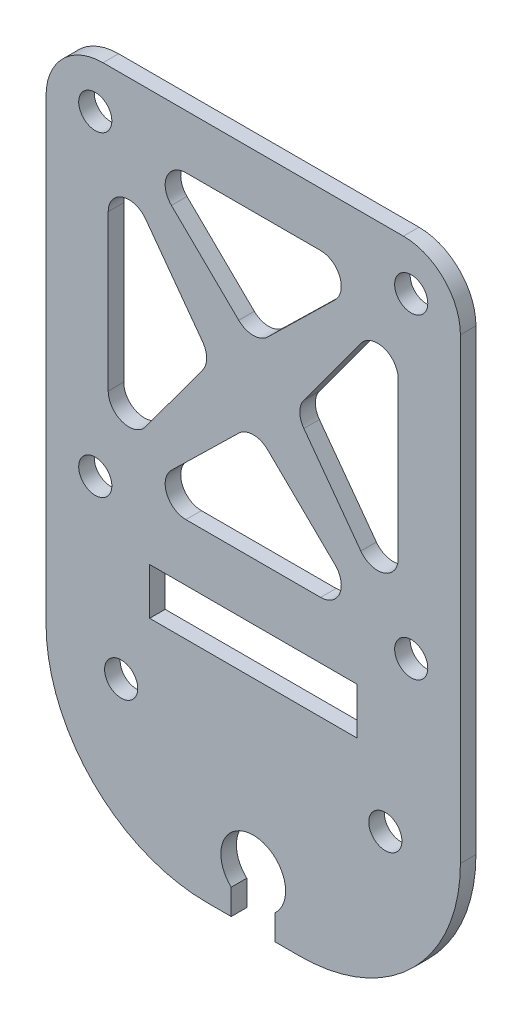
from build123d import *

# Parameters (mm, degrees)
SKETCH1_R           = 1.6
SKETCH1_W           = 20
SKETCH1_H           = 4.5
BOSS_EXTRUDE1_DEPTH = 0.75


with BuildPart() as part:
    # Sketch1 → Boss-Extrude1 (new, symmetric)
    with BuildSketch(Plane.XY):
        with BuildLine():
            Line((-20, 14.2), (-20, -30))
            ThreePointArc((-20, -30), (-15.460155108, -40.960155108), (-4.5, -45.5))
            Line((-4.5, -45.5), (-2.123950753, -45.5))
            Line((-2.123950753, -45.5), (-2.123950753, -43.0422605))
            ThreePointArc((-2.123950753, -43.0422605), (0, -37.625), (2.123950753, -43.0422605))
            Line((2.123950753, -43.0422605), (2.123950753, -45.5))
            Line((2.123950753, -45.5), (4.5, -45.5))
            ThreePointArc((4.5, -45.5), (15.460155108, -40.960155108), (20, -30))
            Line((20, -30), (20, 14.2))
            ThreePointArc((20, 14.2), (18.389087297, 18.089087297), (14.5, 19.7))
            Line((14.5, 19.7), (-14.5, 19.7))
            ThreePointArc((-14.5, 19.7), (-18.389087297, 18.089087297), (-20, 14.2))
        make_face()
        with Locations((-15.25, 15.25)):
            Circle(SKETCH1_R, mode=Mode.SUBTRACT)
        with Locations((15.25, 15.25)):
            Circle(SKETCH1_R, mode=Mode.SUBTRACT)
        with Locations((15.25, -15.25)):
            Circle(SKETCH1_R, mode=Mode.SUBTRACT)
        with Locations((-15.25, -15.25)):
            Circle(SKETCH1_R, mode=Mode.SUBTRACT)
        with Locations((12.75, -30.95)):
            Circle(SKETCH1_R, mode=Mode.SUBTRACT)
        with Locations((-12.75, -30.95)):
            Circle(SKETCH1_R, mode=Mode.SUBTRACT)
        with Locations((0, -22.25)):
            Rectangle(SKETCH1_W, SKETCH1_H, mode=Mode.SUBTRACT)
        with BuildLine():
            Line((-14, 7.5), (-14, -7.5))
            ThreePointArc((-14, -7.5), (-12.622245939, -9.400739328), (-10.387190008, -8.682727327))
            Line((-10.387190008, -8.682727327), (-4.887190008, -1.182727327))
            ThreePointArc((-4.887190008, -1.182727327), (-4.5, 0), (-4.887190008, 1.182727327))
            Line((-4.887190008, 1.182727327), (-10.387190008, 8.682727327))
            ThreePointArc((-10.387190008, 8.682727327), (-12.622245939, 9.400739328), (-14, 7.5))
        make_face(mode=Mode.SUBTRACT)
        with BuildLine():
            Line((4.887190008, 1.182727327), (10.387190008, 8.682727327))
            ThreePointArc((10.387190008, 8.682727327), (12.622245939, 9.400739328), (14, 7.5))
            Line((14, 7.5), (14, -7.5))
            ThreePointArc((14, -7.5), (12.622245939, -9.400739328), (10.387190008, -8.682727327))
            Line((10.387190008, -8.682727327), (4.887190008, -1.182727327))
            ThreePointArc((4.887190008, -1.182727327), (4.5, 0), (4.887190008, 1.182727327))
        make_face(mode=Mode.SUBTRACT)
        with BuildLine():
            Line((-7.897610015, 11.069375575), (-1.397610015, 4.719375575))
            ThreePointArc((-1.397610015, 4.719375575), (0, 4.15), (1.397610015, 4.719375575))
            Line((1.397610015, 4.719375575), (7.897610015, 11.069375575))
            ThreePointArc((7.897610015, 11.069375575), (8.352194489, 13.254569795), (6.5, 14.5))
            Line((6.5, 14.5), (-6.5, 14.5))
            ThreePointArc((-6.5, 14.5), (-8.352194489, 13.254569795), (-7.897610015, 11.069375575))
        make_face(mode=Mode.SUBTRACT)
        with BuildLine():
            Line((6.5, -14.5), (-6.5, -14.5))
            ThreePointArc((-6.5, -14.5), (-8.352194489, -13.254569795), (-7.897610015, -11.069375575))
            Line((-7.897610015, -11.069375575), (-1.397610015, -4.719375575))
            ThreePointArc((-1.397610015, -4.719375575), (0, -4.15), (1.397610015, -4.719375575))
            Line((1.397610015, -4.719375575), (7.897610015, -11.069375575))
            ThreePointArc((7.897610015, -11.069375575), (8.352194489, -13.254569795), (6.5, -14.5))
        make_face(mode=Mode.SUBTRACT)
    extrude(amount=BOSS_EXTRUDE1_DEPTH, both=True)


solid = part.part
